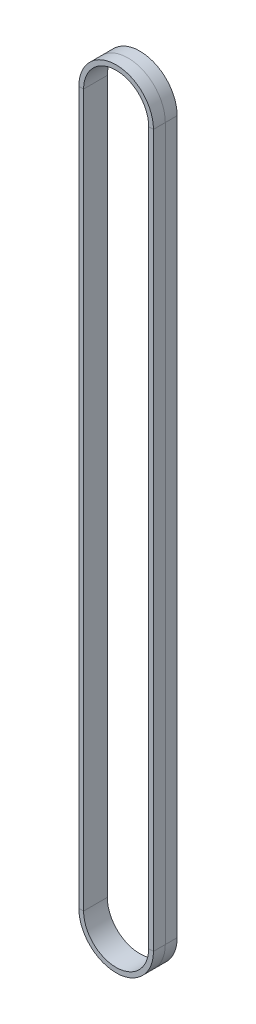
from build123d import *


with BuildPart() as part:
    # 扫描1: sweep along a path in 草图2
    with BuildLine(Plane.XY) as sweep_1_path:
        Line((-43.609540078, 0), (-43.609540078, 300))
        ThreePointArc((-43.609540078, 300), (-29.664540078, 313.945), (-15.719540078, 300))
        Line((-15.719540078, 300), (-15.719540078, 0))
        ThreePointArc((-15.719540078, 0), (-29.664540078, -13.945), (-43.609540078, 0))
    # 草图4 → 扫描1 (sweep)
    with BuildSketch(Plane(origin=(0, 0, 0), x_dir=(1, 0, 0), z_dir=(0, 1, 0))):
        Polygon((-13.945, 0), (-13.945, 5), (-15.945, 5), (-15.945, -5), (-13.945, -5), align=None)
    sweep(path=sweep_1_path.line)


solid = part.part
